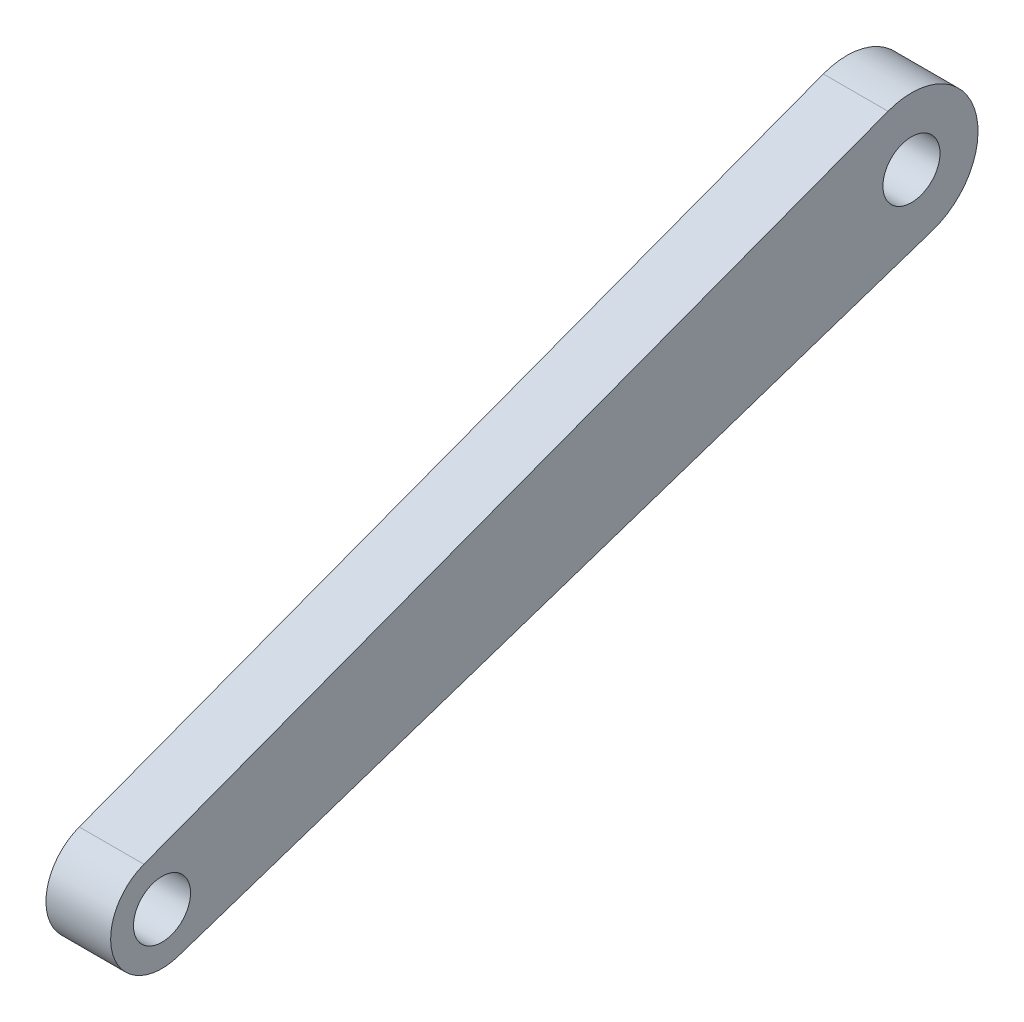
from build123d import *

# Parameters (mm, degrees)
BOSS_EXTRUDE1_DEPTH      = 1.7
BOSS_EXTRUDE1_DEPTH_BACK = 1.7
SKETCH1_R                = 1.5


with BuildPart() as part:
    # Sketch1 → Boss-Extrude1 (new, two sides: drawn at the far end of the back side and taken through both)
    with BuildSketch(Plane(origin=(0, 0, 0), x_dir=(0, 0, -1), z_dir=(1, 0, 0)).offset(-BOSS_EXTRUDE1_DEPTH_BACK)):
        with BuildLine():
            Line((43.152237127, 13.072535054), (4.028300378, -1.651140858))
            ThreePointArc((4.028300378, -1.651140858), (2.434576682, -5.080582662), (5.832896346, -6.739633526))
            Line((5.832896346, -6.739633526), (45.491528196, 6.476340855))
            ThreePointArc((45.491528196, 6.476340855), (47.683700998, 10.966681751), (43.152237127, 13.072535054))
        make_face()
        with Locations((44.385, 9.796822048)):
            Circle(SKETCH1_R, mode=Mode.SUBTRACT)
        with Locations((4.97928888, -4.178119463)):
            Circle(SKETCH1_R, mode=Mode.SUBTRACT)
    extrude(amount=BOSS_EXTRUDE1_DEPTH + BOSS_EXTRUDE1_DEPTH_BACK)


solid = part.part
